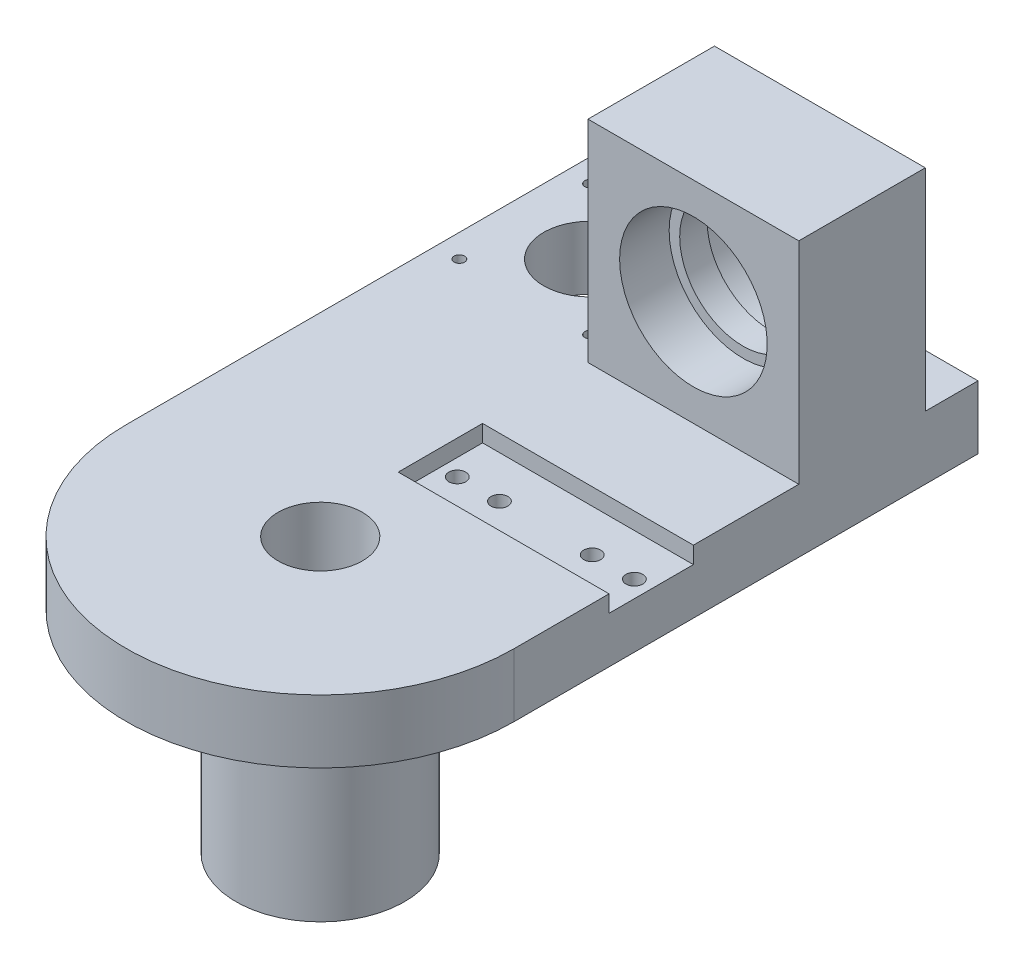
from build123d import *

# Parameters (mm, degrees)
SKIZZE1_W                        = 42
SKIZZE1_H                        = 42
SKIZZE1_R                        = 1.25
SKIZZE1_R_2                      = 11
AUFSATZ_LINEAR_AUSTRAGEN1_DEPTH  = 15
SKIZZE2_W                        = 50
SKIZZE2_H                        = 30
AUFSATZ_LINEAR_AUSTRAGEN2_DEPTH  = 50
SKIZZE3_R                        = 15
SCHNITT_LINEAR_AUSTRAGEN9_DEPTH  = 30
SKIZZE4_R                        = 17.5
SCHNITT_LINEAR_AUSTRAGEN10_DEPTH = 11.75
SKIZZE5_W                        = 50
SKIZZE5_H                        = 20
SCHNITT_LINEAR_AUSTRAGEN3_DEPTH  = 4
SKIZZE6_R                        = 2
SCHNITT_LINEAR_AUSTRAGEN4_DEPTH  = 11
SKIZZE8_R                        = 32.5
SKIZZE8_R_2                      = 26.25
SCHNITT_LINEAR_AUSTRAGEN5_DEPTH  = 4
SKIZZE10_R                       = 20
AUFSATZ_LINEAR_AUSTRAGEN3_DEPTH  = 50
SKIZZE11_R                       = 3.5
SCHNITT_LINEAR_AUSTRAGEN6_DEPTH  = 8
SKIZZE12_R                       = 10
SCHNITT_LINEAR_AUSTRAGEN7_DEPTH  = 65
SKIZZE13_R                       = 2
SCHNITT_LINEAR_AUSTRAGEN8_DEPTH  = 15


with BuildPart() as part:
    # Skizze1 → Aufsatz-Linear austragen1 (new body)
    # profile 1 of 4: a face of its own
    with BuildSketch(Plane(origin=(0, 0, 0), x_dir=(1, 0, 0), z_dir=(0, 1, 0))):
        with BuildLine():
            ThreePointArc((46, 0), (0, 46), (-46, 0))
            Line((-46, 0), (46, 0))
        make_face()
    # profile 2 of 4: a face of its own
    with BuildSketch(Plane(origin=(0, 0, 0), x_dir=(1, 0, 0), z_dir=(0, 1, 0))):
        with BuildLine():
            Line((-46, 68), (-46, 0))
            ThreePointArc((-46, 0), (0, 46), (46, 0))
            Line((46, 0), (46, 110))
            Line((46, 110), (-4, 110))
            Line((-4, 110), (-4, 68))
            Line((-4, 68), (-46, 68))
        make_face()
    # profile 3 of 4: a face of its own
    with BuildSketch(Plane(origin=(0, 0, 0), x_dir=(1, 0, 0), z_dir=(0, 1, 0))):
        with BuildLine():
            Line((46, 0), (-46, 0))
            ThreePointArc((-46, 0), (0, -46), (46, 0))
        make_face()
    # profile 4 of 4: a face of its own
    with BuildSketch(Plane(origin=(0, 0, 0), x_dir=(1, 0, 0), z_dir=(0, 1, 0))):
        with Locations((-25, 89)):
            Rectangle(SKIZZE1_W, SKIZZE1_H)
        with Locations(Location((-40.5, 73.5, 0), (0, 0, 270))):
            Circle(SKIZZE1_R, mode=Mode.SUBTRACT)
        with Locations(Location((-25, 89, 0), (0, 0, 270))):
            Circle(SKIZZE1_R_2, mode=Mode.SUBTRACT)
        with Locations(Location((-40.5, 104.5, 0), (0, 0, 270))):
            Circle(SKIZZE1_R, mode=Mode.SUBTRACT)
        with Locations(Location((-9.5, 73.5, 0), (0, 0, 270))):
            Circle(SKIZZE1_R, mode=Mode.SUBTRACT)
        with Locations(Location((-9.5, 104.5, 0), (0, 0, 270))):
            Circle(SKIZZE1_R, mode=Mode.SUBTRACT)
    extrude(amount=AUFSATZ_LINEAR_AUSTRAGEN1_DEPTH)

    # Skizze2 → Aufsatz-Linear austragen2 (add)
    with BuildSketch(Plane(origin=(0, 15, 0), x_dir=(1, 0, 0), z_dir=(0, 1, 0))):
        with Locations((21, 82.5)):
            Rectangle(SKIZZE2_W, SKIZZE2_H)
    extrude(amount=AUFSATZ_LINEAR_AUSTRAGEN2_DEPTH)

    # Skizze3 → Schnitt-Linear austragen9 (cut)
    with BuildSketch(Plane(origin=(0, 0, -97.5), x_dir=(-1, 0, 0), z_dir=(0, 0, -1))):
        with Locations((-21, 40)):
            Circle(SKIZZE3_R)
    extrude(amount=-SCHNITT_LINEAR_AUSTRAGEN9_DEPTH, mode=Mode.SUBTRACT)

    # Skizze4 → Schnitt-Linear austragen10 (cut)
    with BuildSketch(Plane(origin=(0, 0, -97.5), x_dir=(-1, 0, 0), z_dir=(0, 0, -1))):
        with Locations((-21, 40)):
            Circle(SKIZZE4_R)
    schnitt_linear_austragen10 = extrude(amount=-SCHNITT_LINEAR_AUSTRAGEN10_DEPTH, mode=Mode.SUBTRACT)

    # Skizze5 → Schnitt-Linear austragen3 (cut)
    with BuildSketch(Plane(origin=(0, 15, 0), x_dir=(1, 0, 0), z_dir=(0, 1, 0))):
        with Locations((21, 32.5)):
            Rectangle(SKIZZE5_W, SKIZZE5_H)
    extrude(amount=-SCHNITT_LINEAR_AUSTRAGEN3_DEPTH, mode=Mode.SUBTRACT)

    # Skizze6 → Schnitt-Linear austragen4 (cut)
    with BuildSketch(Plane(origin=(0, 11, 0), x_dir=(1, 0, 0), z_dir=(0, 1, 0))):
        with Locations(Location((0, 32.5, 0), (0, 0, 270))):
            Circle(SKIZZE6_R)
        with Locations(Location((42, 32.5, 0), (0, 0, 90))):
            Circle(SKIZZE6_R)
        with Locations(Location((10, 32.5, 0), (0, 0, 270))):
            Circle(SKIZZE6_R)
        with Locations(Location((32, 32.5, 0), (0, 0, 90))):
            Circle(SKIZZE6_R)
    extrude(amount=-SCHNITT_LINEAR_AUSTRAGEN4_DEPTH, mode=Mode.SUBTRACT)

    # Skizze8 → Schnitt-Linear austragen5 (cut)
    with BuildSketch(Plane.XZ):
        Circle(SKIZZE8_R)
        with Locations(Location((0, 0, 0), (0, 0, 270))):
            Circle(SKIZZE8_R_2, mode=Mode.SUBTRACT)
    extrude(amount=-SCHNITT_LINEAR_AUSTRAGEN5_DEPTH, mode=Mode.SUBTRACT)

    # Skizze10 → Aufsatz-Linear austragen3 (add)
    with BuildSketch(Plane.XZ):
        with Locations(Location((0, 0, 0), (0, 0, 270))):
            Circle(SKIZZE10_R)
    extrude(amount=AUFSATZ_LINEAR_AUSTRAGEN3_DEPTH)

    # Skizze11 → Schnitt-Linear austragen6 (cut)
    with BuildSketch(Plane.XZ):
        with Locations(Location((0, -32.5, 0), (0, 0, 3.086650162))):
            Circle(SKIZZE11_R)
        with Locations(Location((10, -32.5, 0), (0, 0, 168.965324237))):
            Circle(SKIZZE11_R)
        with Locations(Location((32, -32.5, 0), (0, 0, 270))):
            Circle(SKIZZE11_R)
        with Locations(Location((42, -32.5, 0), (0, 0, 270))):
            Circle(SKIZZE11_R)
    extrude(amount=-SCHNITT_LINEAR_AUSTRAGEN6_DEPTH, mode=Mode.SUBTRACT)

    # Skizze12 → Schnitt-Linear austragen7 (cut)
    with BuildSketch(Plane.XZ.offset(50)):
        with Locations(Location((0, 0, 0), (0, 0, 270))):
            Circle(SKIZZE12_R)
    extrude(amount=-SCHNITT_LINEAR_AUSTRAGEN7_DEPTH, mode=Mode.SUBTRACT)

    # Skizze13 → Schnitt-Linear austragen8 (cut)
    with BuildSketch(Plane.XZ.offset(50)):
        with Locations(Location((15, 0, 0), (0, 0, 270))):
            Circle(SKIZZE13_R)
        with Locations(Location((7.5, -12.990381057, 0), (0, 0, 270))):
            Circle(SKIZZE13_R)
        with Locations(Location((-7.5, -12.990381057, 0), (0, 0, 270))):
            Circle(SKIZZE13_R)
        with Locations(Location((-15, 0, 0), (0, 0, 270))):
            Circle(SKIZZE13_R)
        with Locations(Location((-7.5, 12.990381057, 0), (0, 0, 270))):
            Circle(SKIZZE13_R)
        with Locations(Location((7.5, 12.990381057, 0), (0, 0, 270))):
            Circle(SKIZZE13_R)
    extrude(amount=-SCHNITT_LINEAR_AUSTRAGEN8_DEPTH, mode=Mode.SUBTRACT)

    # Spiegeln2: Schnitt-Linear austragen10 across plane
    add(schnitt_linear_austragen10.mirror(Plane(origin=(0, 0, -82.5), x_dir=(1, 0, 0), z_dir=(0, 0, -1))), mode=Mode.SUBTRACT)


solid = part.part
